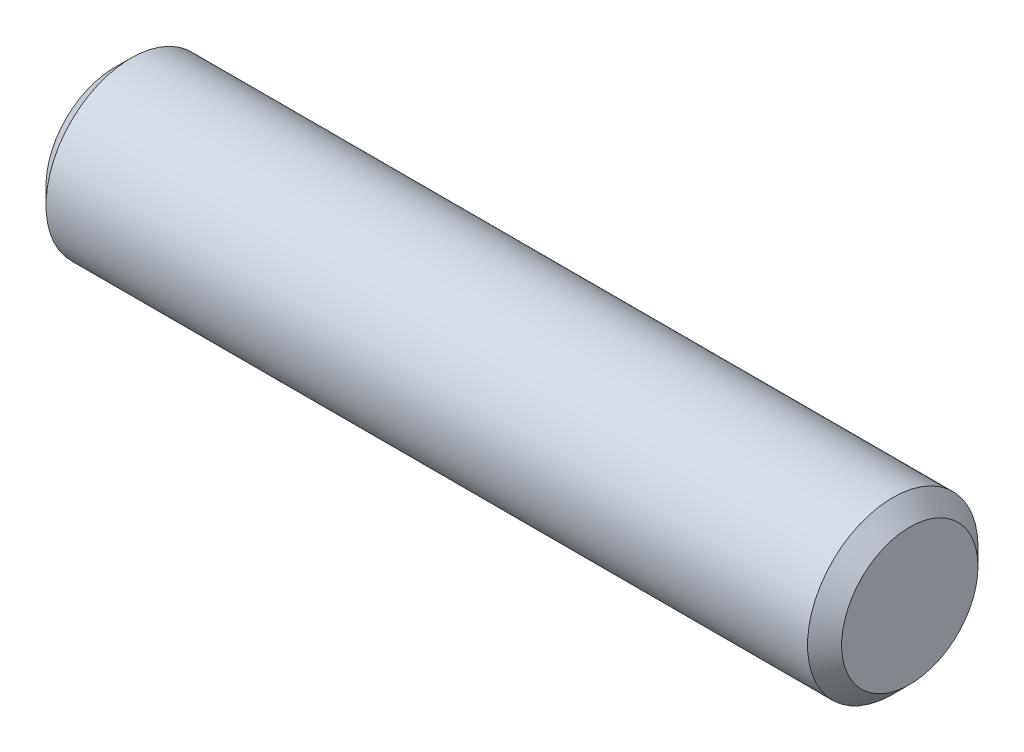
from build123d import *

# Parameters (mm, degrees)
SKETCH2_R           = 1.5
BOSS_EXTRUDE1_DEPTH = 7
CHAMFER2_SIZE       = 0.3


with BuildPart() as part:
    # Sketch2 → Boss-Extrude1 (new, symmetric)
    with BuildSketch(Plane(origin=(0, 0, 0), x_dir=(0, 0, -1), z_dir=(1, 0, 0))):
        Circle(SKETCH2_R)
    extrude(amount=BOSS_EXTRUDE1_DEPTH, both=True)

    # Chamfer2
    chamfer2_edges = [part.edges().sort_by_distance(p)[0] for p in [
        (7, 0, 1.5),
        (-7, 0, 1.5),
    ]]
    chamfer(chamfer2_edges, length=CHAMFER2_SIZE)


solid = part.part
